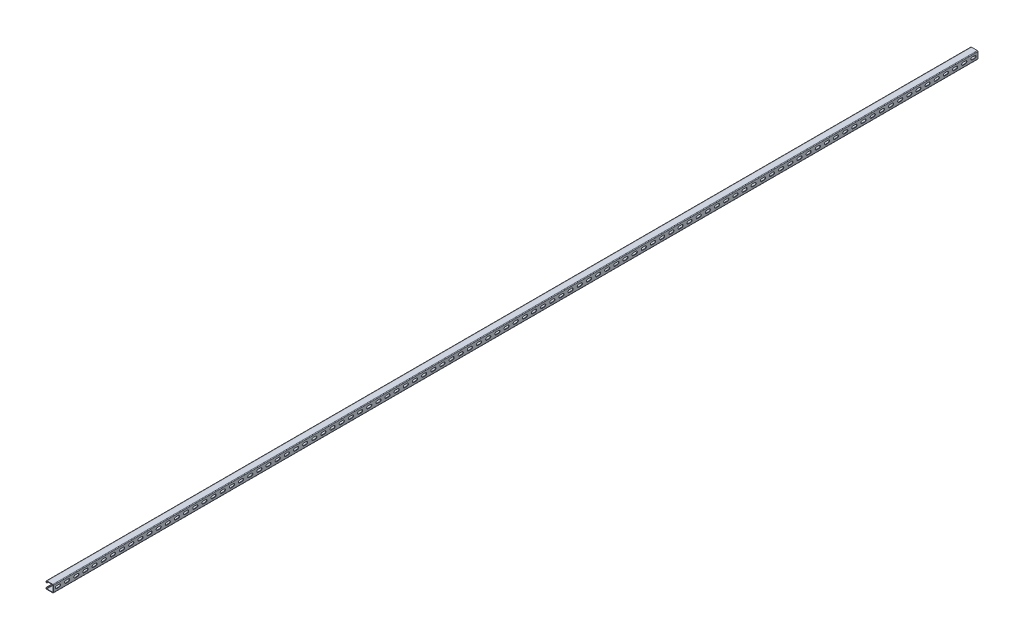
from build123d import *

# Parameters (mm, degrees)
BOSS_EXTRUDE1_DEPTH = 5130.8
CUT_EXTRUDE1_DEPTH  = 2.794
LPATTERN1_COUNT     = 101
LPATTERN1_PITCH     = 50.8


with BuildPart() as part:
    # Sketch1 → Boss-Extrude1 (new body)
    with BuildSketch(Plane.XY):
        with BuildLine():
            Line((-36.22675, 20.6375), (-3.46075, 20.6375))
            ThreePointArc((-3.46075, 20.6375), (-1.013630207, 19.623869793), (0, 17.17675))
            Line((0, 17.17675), (0, -17.17675))
            ThreePointArc((0, -17.17675), (-1.013630207, -19.623869793), (-3.46075, -20.6375))
            Line((-3.46075, -20.6375), (-36.22675, -20.6375))
            ThreePointArc((-36.22675, -20.6375), (-39.796401808, -19.158901808), (-41.275, -15.58925))
            Line((-41.275, -15.58925), (-41.275, -14.57325))
            ThreePointArc((-41.275, -14.57325), (-40.261369793, -12.126130207), (-37.81425, -11.1125))
            Line((-37.81425, -11.1125), (-35.5346, -11.1125))
            ThreePointArc((-35.5346, -11.1125), (-34.1376, -12.5095), (-35.5346, -13.9065))
            Line((-35.5346, -13.9065), (-37.81425, -13.9065))
            ThreePointArc((-37.81425, -13.9065), (-38.285713446, -14.101786554), (-38.481, -14.57325))
            Line((-38.481, -14.57325), (-38.481, -15.58925))
            ThreePointArc((-38.481, -15.58925), (-37.820745461, -17.183245461), (-36.22675, -17.8435))
            Line((-36.22675, -17.8435), (-3.46075, -17.8435))
            ThreePointArc((-3.46075, -17.8435), (-2.989286554, -17.648213446), (-2.794, -17.17675))
            Line((-2.794, -17.17675), (-2.794, 17.17675))
            ThreePointArc((-2.794, 17.17675), (-2.989286554, 17.648213446), (-3.46075, 17.8435))
            Line((-3.46075, 17.8435), (-36.22675, 17.8435))
            ThreePointArc((-36.22675, 17.8435), (-37.820745461, 17.183245461), (-38.481, 15.58925))
            Line((-38.481, 15.58925), (-38.481, 14.57325))
            ThreePointArc((-38.481, 14.57325), (-38.285713446, 14.101786554), (-37.81425, 13.9065))
            Line((-37.81425, 13.9065), (-35.5346, 13.9065))
            ThreePointArc((-35.5346, 13.9065), (-34.1376, 12.5095), (-35.5346, 11.1125))
            Line((-35.5346, 11.1125), (-37.81425, 11.1125))
            ThreePointArc((-37.81425, 11.1125), (-40.261369793, 12.126130207), (-41.275, 14.57325))
            Line((-41.275, 14.57325), (-41.275, 15.58925))
            ThreePointArc((-41.275, 15.58925), (-39.796401808, 19.158901808), (-36.22675, 20.6375))
        make_face()
    extrude(amount=-BOSS_EXTRUDE1_DEPTH)

    # Sketch2 → Cut-Extrude1 (cut)
    with BuildSketch(Plane(origin=(0, 0, 0), x_dir=(0, 0, -1), z_dir=(1, 0, 0))):
        with BuildLine():
            Line((18.25625, 7.14375), (32.54375, 7.14375))
            ThreePointArc((32.54375, 7.14375), (39.6875, 0), (32.54375, -7.14375))
            Line((32.54375, -7.14375), (18.25625, -7.14375))
            ThreePointArc((18.25625, -7.14375), (11.1125, 0), (18.25625, 7.14375))
        make_face()
    cut_extrude1 = extrude(amount=-CUT_EXTRUDE1_DEPTH, mode=Mode.SUBTRACT)

    # LPattern1: Cut-Extrude1 ×101
    with Locations(*[(0, 0, -i * LPATTERN1_PITCH) for i in range(1, LPATTERN1_COUNT)]):
        add(cut_extrude1, mode=Mode.SUBTRACT)


solid = part.part
